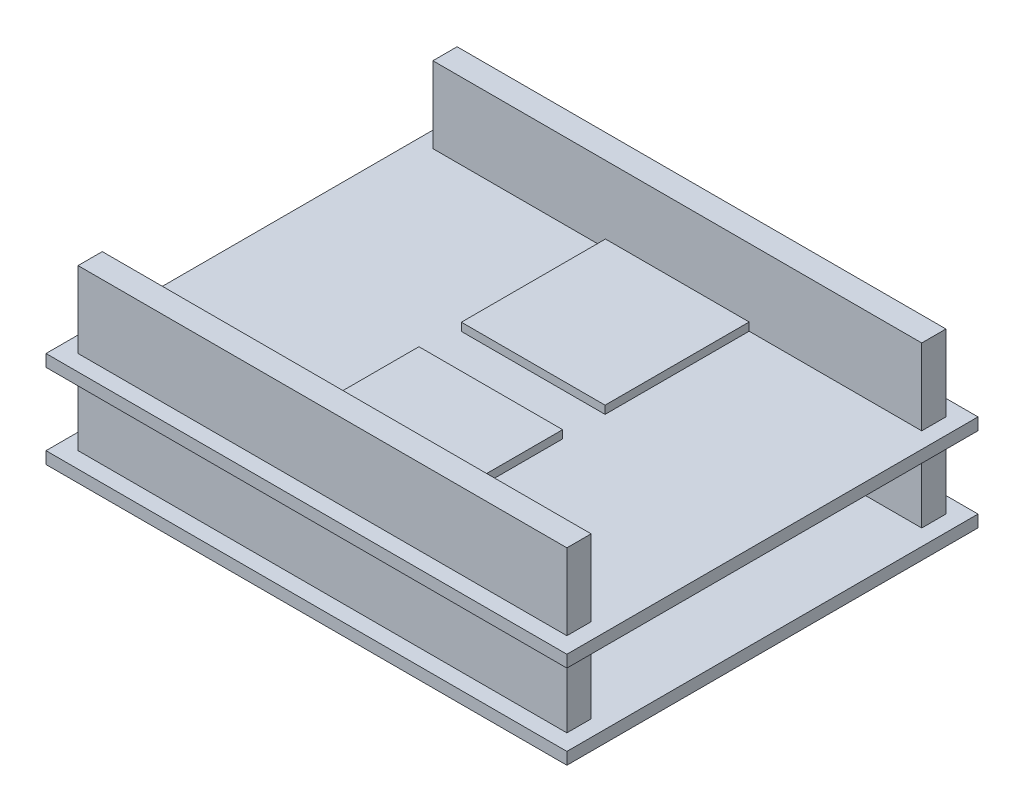
from build123d import *

# Parameters (mm, degrees)
SKETCH1_W                = 65
SKETCH1_H                = 51.3
BOSS_EXTRUDE1_DEPTH      = 1.5
SKETCH2_W                = 17.929597568
SKETCH2_H                = 18
BOSS_EXTRUDE2_DEPTH      = 1
BOSS_EXTRUDE3_DEPTH      = 9
BOSS_EXTRUDE3_DEPTH_BACK = 11
SKETCH4_W                = 61
SKETCH4_H                = 3.022614149
SKETCH5_W                = 65
SKETCH5_H                = 51.3
BOSS_EXTRUDE4_DEPTH      = 1.5


with BuildPart() as part:
    # Sketch1 → Boss-Extrude1 (new body)
    with BuildSketch(Plane(origin=(0, 0, 0), x_dir=(1, 0, 0), z_dir=(0, 1, 0))):
        Rectangle(SKETCH1_W, SKETCH1_H)
    extrude(amount=BOSS_EXTRUDE1_DEPTH)

    # Sketch2 → Boss-Extrude2 (add)
    with BuildSketch(Plane(origin=(0, 1.5, 0), x_dir=(1, 0, 0), z_dir=(0, 1, 0))):
        with Locations((0, 11.65)):
            Rectangle(SKETCH2_W, SKETCH2_H)
        with Locations((0, -11.65)):
            Rectangle(SKETCH2_W, SKETCH2_H)
    extrude(amount=BOSS_EXTRUDE2_DEPTH)

    # Sketch4 → Boss-Extrude3 (add, two sides: drawn at the far end of the back side and taken through both)
    with BuildSketch(Plane.XZ.offset(-BOSS_EXTRUDE3_DEPTH_BACK)):
        with Locations((0, 22.138692926)):
            Rectangle(SKETCH4_W, SKETCH4_H)
        with Locations((0, -22.138692926)):
            Rectangle(SKETCH4_W, SKETCH4_H)
    extrude(amount=BOSS_EXTRUDE3_DEPTH + BOSS_EXTRUDE3_DEPTH_BACK)

    # Sketch5 → Boss-Extrude4 (add)
    with BuildSketch(Plane.XZ.offset(9)):
        Rectangle(SKETCH5_W, SKETCH5_H)
    extrude(amount=BOSS_EXTRUDE4_DEPTH)


solid = part.part
